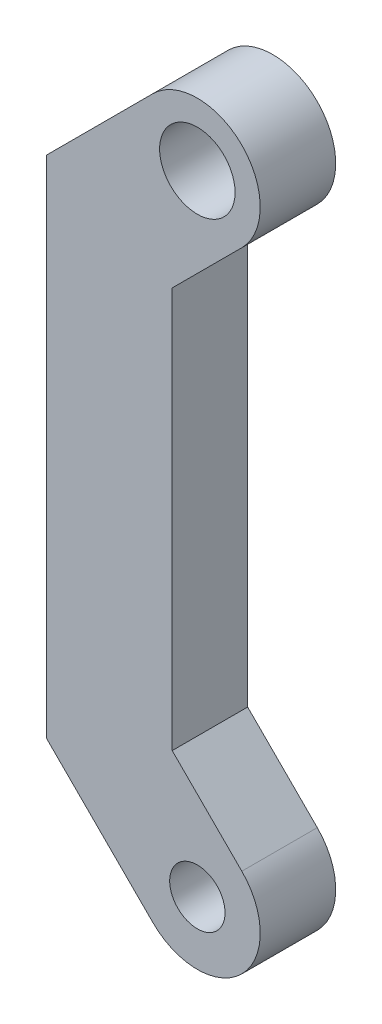
from build123d import *

# Parameters (mm, degrees)
CROQUIS1_R              = 2.5
CROQUIS1_R_2            = 1.5
CROQUIS1_R_3            = 1.1
SALIENTE_EXTRUIR1_DEPTH = 3


with BuildPart() as part:
    # Croquis1 → Saliente-Extruir1 (new body)
    # profile 1 of 3: a face of its own
    with BuildSketch(Plane.XY):
        with BuildLine():
            ThreePointArc((-1.767766953, -1.767766953), (-1.767766953, 1.767766953), (1.767766953, 1.767766953))
            Line((1.767766953, 1.767766953), (-1, 4.535533906))
            Line((-1, 4.535533906), (-1, 20.464466094))
            Line((-1, 20.464466094), (1.767766953, 23.232233047))
            ThreePointArc((1.767766953, 23.232233047), (-1.767766953, 23.232233047), (-1.767766953, 26.767766953))
            Line((-1.767766953, 26.767766953), (-6, 22.535533906))
            Line((-6, 22.535533906), (-6, 2.464466094))
            Line((-6, 2.464466094), (-1.767766953, -1.767766953))
        make_face()
    # profile 2 of 3: a face of its own
    with BuildSketch(Plane.XY):
        with Locations((0, 25)):
            Circle(CROQUIS1_R)
        with Locations((0, 25)):
            Circle(CROQUIS1_R_2, mode=Mode.SUBTRACT)
    # profile 3 of 3: a face of its own
    with BuildSketch(Plane.XY):
        Circle(CROQUIS1_R)
        Circle(CROQUIS1_R_3, mode=Mode.SUBTRACT)
    extrude(amount=SALIENTE_EXTRUIR1_DEPTH)


solid = part.part
